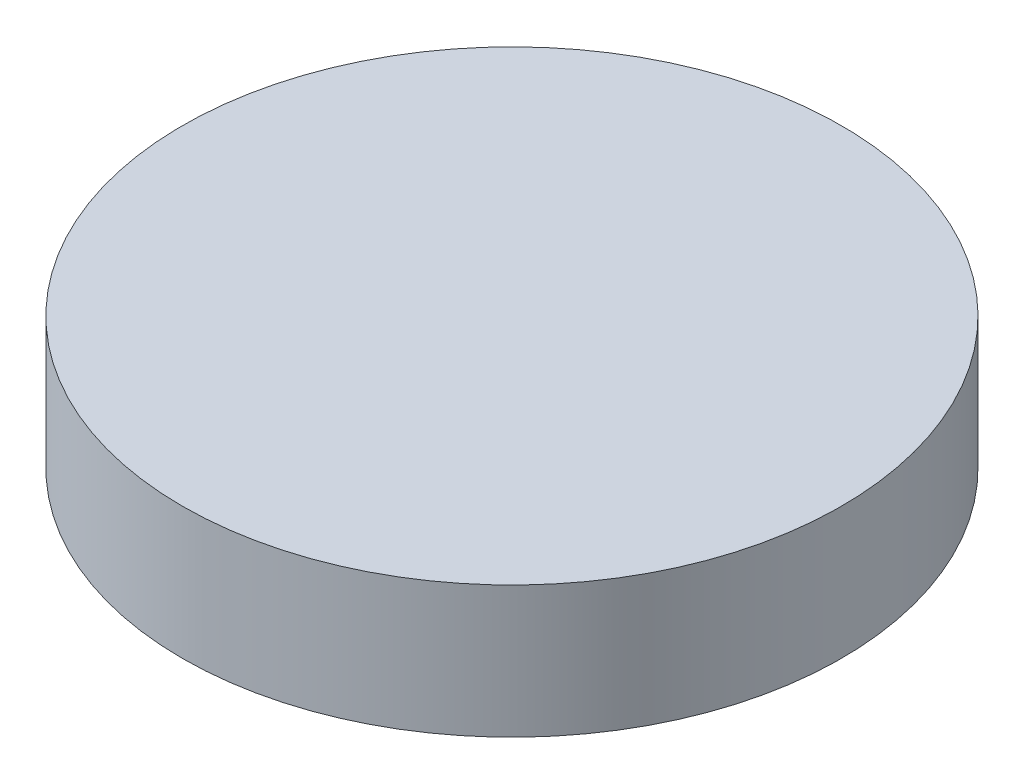
from build123d import *

# Parameters (mm, degrees)
SKETCH1_R           = 8
BOSS_EXTRUDE1_DEPTH = 3.2


with BuildPart() as part:
    # Sketch1 → Boss-Extrude1 (new body)
    with BuildSketch(Plane(origin=(0, 0, 0), x_dir=(1, 0, 0), z_dir=(0, 1, 0))):
        with Locations(Location((0, 0, 0), (0, 0, 270))):
            Circle(SKETCH1_R)
    extrude(amount=BOSS_EXTRUDE1_DEPTH)


solid = part.part
